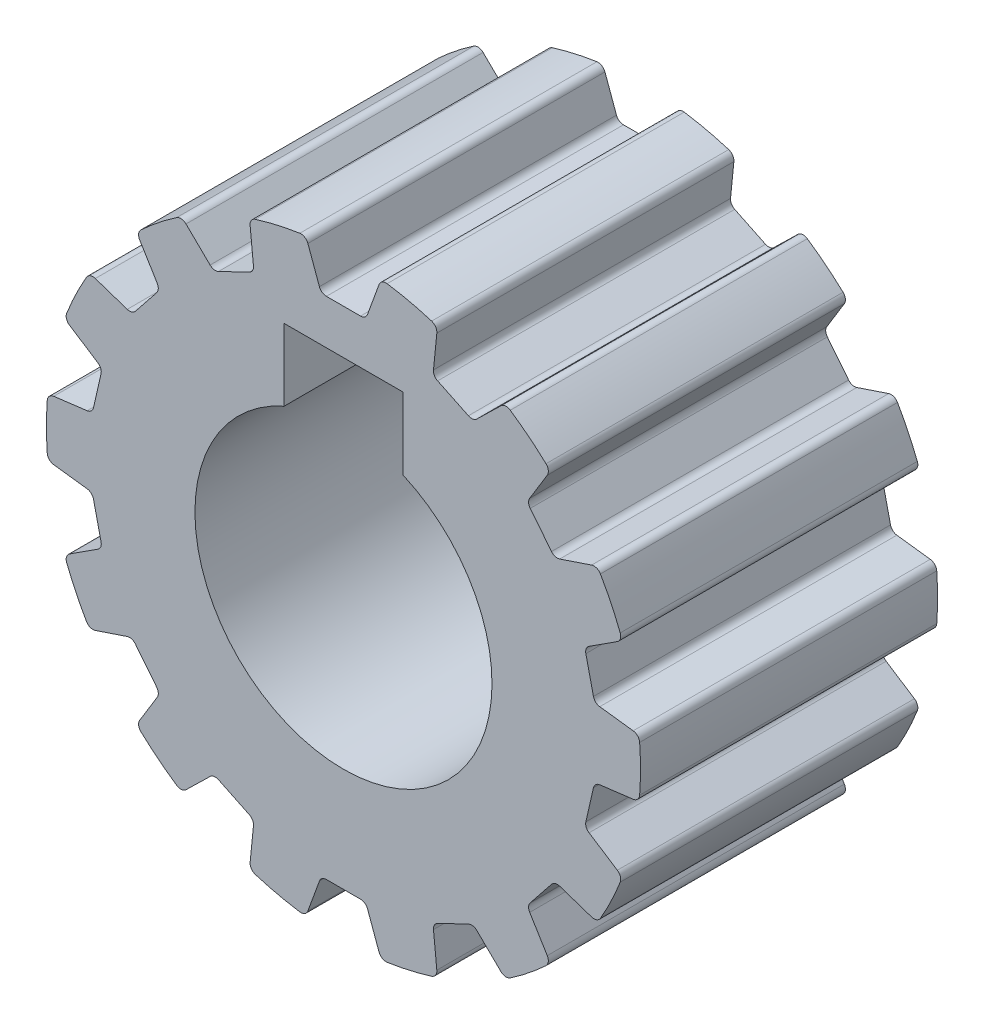
from build123d import *

# Parameters (mm, degrees)
SKETCH1_R           = 10
BOSS_EXTRUDE1_DEPTH = 10
CUT_EXTRUDE1_START  = -10
CUT_EXTRUDE1_DEPTH  = 28.320508076
CIRPATTERN1_COUNT   = 14
FILLET2_R           = 0.25


with BuildPart() as part:
    # Sketch1 → Boss-Extrude1 (new body)
    with BuildSketch(Plane.XY):
        Circle(SKETCH1_R)
        with BuildLine():
            Line((-2, 7), (2, 7))
            Line((2, 7), (2, 4.582575695))
            ThreePointArc((2, 4.582575695), (0, -5), (-2, 4.582575695))
            Line((-2, 4.582575695), (-2, 7))
        make_face(mode=Mode.SUBTRACT)
    extrude(amount=BOSS_EXTRUDE1_DEPTH)

    # Sketch2 → Cut-Extrude1 (cut)
    with BuildSketch(Plane.XY.offset(10).offset(CUT_EXTRUDE1_START)):
        with BuildLine():
            Line((0, 10), (0, 8.5))
            Line((0, 8.5), (0.75, 8.5))
            Line((0.75, 8.5), (1.266640021, 9.919456792))
            ThreePointArc((1.266640021, 9.919456792), (0.634599116, 9.979843885), (0, 10))
        make_face()
        with BuildLine():
            Line((-0.75, 8.5), (0, 8.5))
            Line((0, 8.5), (0, 10))
            ThreePointArc((0, 10), (-0.634599116, 9.979843885), (-1.266640021, 9.919456792))
            Line((-1.266640021, 9.919456792), (-0.75, 8.5))
        make_face()
    cut_extrude1 = extrude(amount=CUT_EXTRUDE1_DEPTH, mode=Mode.SUBTRACT)

    # CirPattern1: Cut-Extrude1 ×14 about axis
    cirpattern1_axis = Axis((0, 0, 0), (0, 0, 1))
    for i in range(1, CIRPATTERN1_COUNT):
        add(cut_extrude1.rotate(cirpattern1_axis, i * 360 / CIRPATTERN1_COUNT), mode=Mode.SUBTRACT)

    # Fillet2
    fillet2_edges = [part.edges().sort_by_distance(p)[0] for p in [
        (-8.545080745, 5.194381104, 5),
        (-9.38890138, 3.442169501, 5),
        (-8.119996553, 2.622623873, 5),
        (-8.453777954, 1.160232004, 5),
        (-9.952609221, 0.972404078, 5),
        (-9.952609221, -0.972404078, 5),
        (-8.453777954, -1.160232004, 5),
        (-8.119996553, -2.622623873, 5),
        (-9.38890138, -3.442169501, 5),
        (-8.545080745, -5.194381104, 5),
        (-7.113184952, -4.713289704, 5),
        (-6.17795025, -5.886036928, 5),
        (-6.965606473, -7.174979196, 5),
        (-5.445094229, -8.387547248, 5),
        (-4.363738433, -7.332822573, 5),
        (-3.012285132, -7.983648182, 5),
        (-3.162687777, -9.486696265, 5),
        (-1.266640021, -9.919456792, 5),
        (-0.75, -8.5, 5),
        (0.75, -8.5, 5),
        (1.266640021, -9.919456792, 5),
        (3.162687777, -9.486696265, 5),
        (3.012285132, -7.983648182, 5),
        (4.363738433, -7.332822573, 5),
        (5.445094229, -8.387547248, 5),
        (6.965606473, -7.174979196, 5),
        (6.17795025, -5.886036928, 5),
        (7.113184952, -4.713289704, 5),
        (8.545080745, -5.194381104, 5),
        (9.38890138, -3.442169501, 5),
        (8.119996553, -2.622623873, 5),
        (8.453777954, -1.160232004, 5),
        (9.952609221, -0.972404078, 5),
        (9.952609221, 0.972404078, 5),
        (8.453777954, 1.160232004, 5),
        (8.119996553, 2.622623873, 5),
        (9.38890138, 3.442169501, 5),
        (8.545080745, 5.194381104, 5),
        (7.113184952, 4.713289704, 5),
        (6.17795025, 5.886036928, 5),
        (6.965606473, 7.174979196, 5),
        (5.445094229, 8.387547248, 5),
        (4.363738433, 7.332822573, 5),
        (3.012285132, 7.983648182, 5),
        (3.162687777, 9.486696265, 5),
        (1.266640021, 9.919456792, 5),
        (0.75, 8.5, 5),
        (-0.75, 8.5, 5),
        (-3.162687777, 9.486696265, 5),
        (-3.012285132, 7.983648182, 5),
        (-4.363738433, 7.332822573, 5),
        (-5.445094229, 8.387547248, 5),
        (-6.965606473, 7.174979196, 5),
        (-6.17795025, 5.886036928, 5),
        (-7.113184952, 4.713289704, 5),
        (-1.266640021, 9.919456792, 5),
    ]]
    fillet(fillet2_edges, radius=FILLET2_R)


solid = part.part
